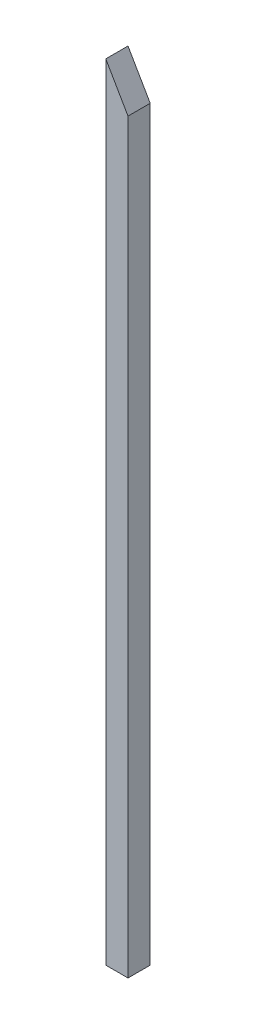
from build123d import *

# Parameters (mm, degrees)
SKETCH_1_W          = 30
SKETCH_1_H          = 30
EXTRUDE_1_DEPTH     = 600
CUT_EXTRUDE_1_REACH = 603.498
CUT_EXTRUDE_2_REACH = 603.498
EXTRUDE_2_DEPTH     = 30
CUT_EXTRUDE_3_DEPTH = 30


with BuildPart() as part:
    # 草图1 → 凸台-拉伸1 (new body)
    with BuildSketch(Plane(origin=(0, 0, 0), x_dir=(1, 0, 0), z_dir=(0, 1, 0))):
        with Locations((15, -15)):
            Rectangle(SKETCH_1_W, SKETCH_1_H)
    extrude(amount=EXTRUDE_1_DEPTH)

    # 草图2 → 切除-拉伸1 (cut, up to next)
    with BuildSketch(Plane.XY.offset(30), mode=Mode.PRIVATE) as cut_extrude_1_sk1:
        Polygon((0, 0), (30, 8.038475773), (30, 0), align=None)
    cut_extrude_1_tool1 = extrude(cut_extrude_1_sk1.sketch, amount=-CUT_EXTRUDE_1_REACH, mode=Mode.PRIVATE) & part.part
    add(cut_extrude_1_tool1.solids().sort_by_distance((20, 2.679492, 30))[0], mode=Mode.SUBTRACT)

    # 草图3 → 切除-拉伸2 (cut, up to next)
    with BuildSketch(Plane(origin=(0, 0, 0), x_dir=(-1, 0, 0), z_dir=(0, 0, -1)), mode=Mode.PRIVATE) as cut_extrude_2_sk1:
        Polygon((0, 600), (-30, 600), (-30, 488.038475773), align=None)
    cut_extrude_2_tool1 = extrude(cut_extrude_2_sk1.sketch, amount=-CUT_EXTRUDE_2_REACH, mode=Mode.PRIVATE) & part.part
    add(cut_extrude_2_tool1.solids().sort_by_distance((20, 562.679492, 0))[0], mode=Mode.SUBTRACT)

    # 草图4 → 凸台-拉伸2 (add)
    with BuildSketch(Plane.XY.offset(30)):
        Polygon((0, 600), (0, -519.62), (30, -519.62), (30, 488.038475773), align=None)
    extrude(amount=-EXTRUDE_2_DEPTH)

    # 草图5 → 切除-拉伸3 (cut)
    with BuildSketch(Plane.XY.offset(30)):
        Polygon((0, 600), (0, 540), (30, 488.038475773), align=None)
    extrude(amount=-CUT_EXTRUDE_3_DEPTH, mode=Mode.SUBTRACT)


solid = part.part
